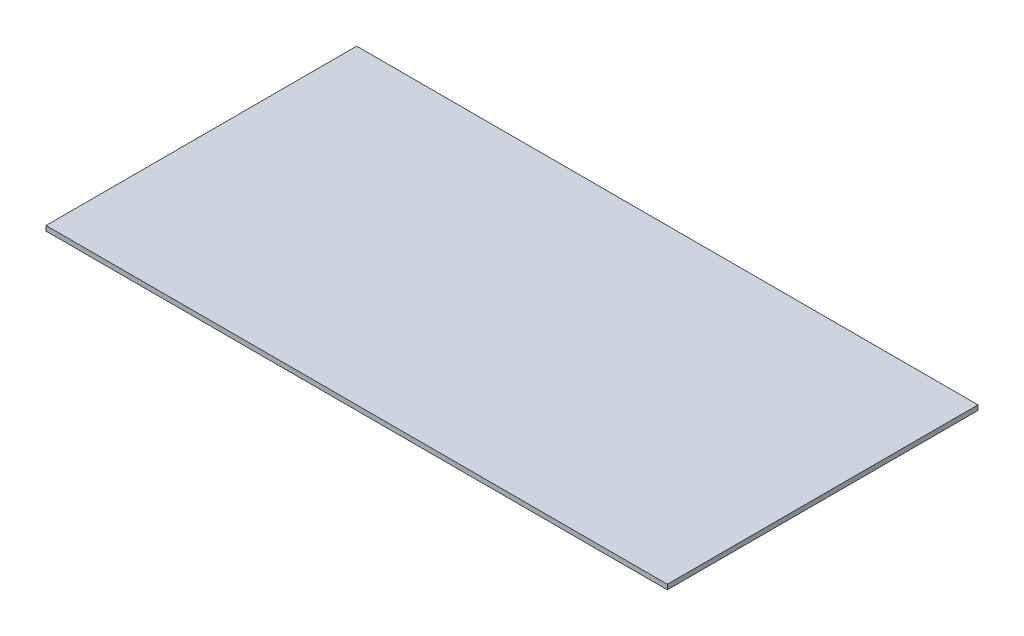
from build123d import *

# Parameters (mm, degrees)
SKETCH1_W           = 2438.4
SKETCH1_H           = 1219.2
BOSS_EXTRUDE1_DEPTH = 19.05


with BuildPart() as part:
    # Sketch1 → Boss-Extrude1 (new body)
    with BuildSketch(Plane(origin=(0, 0, 0), x_dir=(1, 0, 0), z_dir=(0, 1, 0))):
        with Locations((1219.2, 609.6)):
            Rectangle(SKETCH1_W, SKETCH1_H)
    extrude(amount=BOSS_EXTRUDE1_DEPTH)


solid = part.part
